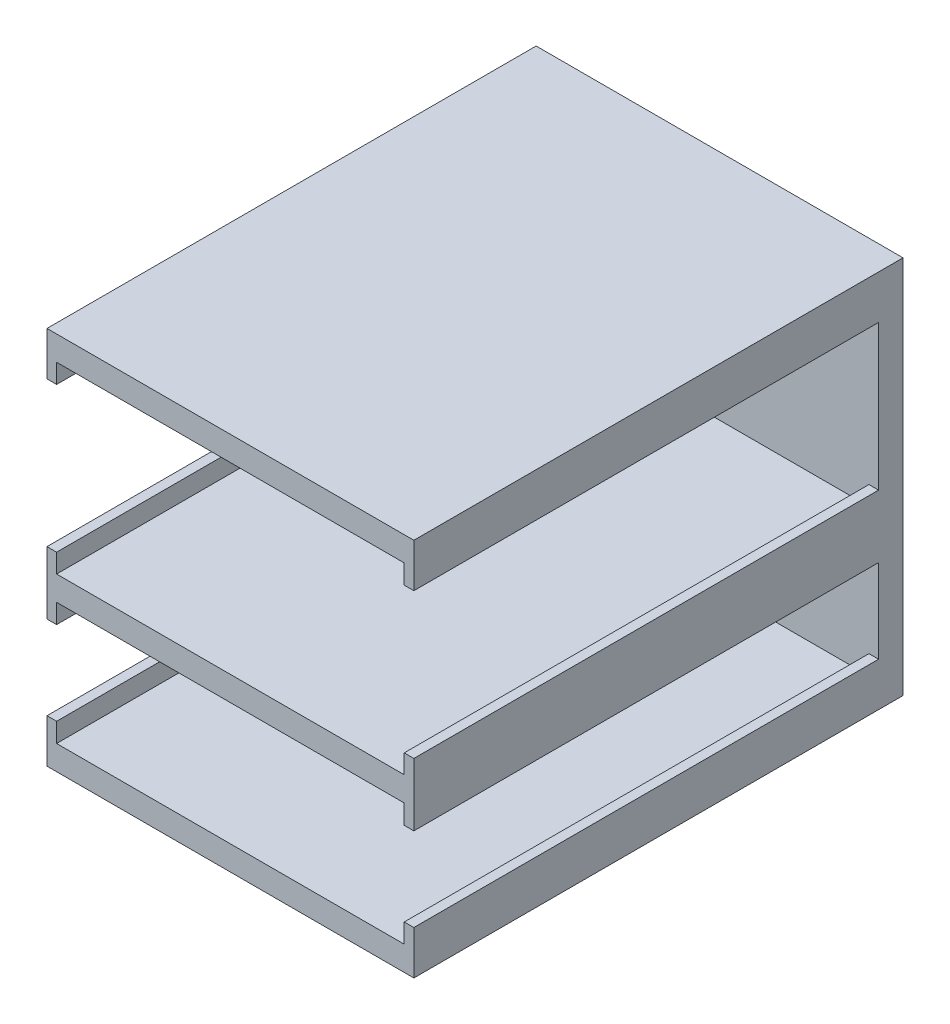
from build123d import *

# Parameters (mm, degrees)
CROQUIS1_W              = 76.2
CROQUIS1_H              = 101.6
SALIENTE_EXTRUIR1_DEPTH = 78.74
CROQUIS2_W              = 76.2
CROQUIS2_H              = 25.4
CORTAR_EXTRUIR1_DEPTH   = 96.52
CROQUIS3_W              = 76.2
CROQUIS3_H              = 38.1
CORTAR_EXTRUIR2_DEPTH   = 96.52
CROQUIS4_W              = 2
CROQUIS4_H              = 96.52
SALIENTE_EXTRUIR3_DEPTH = 73.66
CROQUIS6_W              = 96.52
CROQUIS6_H              = 17.379424015
CORTAR_EXTRUIR4_DEPTH   = 4
CORTAR_EXTRUIR5_DEPTH   = 4


with BuildPart() as part:
    # Croquis1 → Saliente-Extruir1 (new body)
    with BuildSketch(Plane(origin=(0, 0, 0), x_dir=(1, 0, 0), z_dir=(0, 1, 0))):
        Rectangle(CROQUIS1_W, CROQUIS1_H)
    extrude(amount=SALIENTE_EXTRUIR1_DEPTH)

    # Croquis2 → Cortar-Extruir1 (cut)
    with BuildSketch(Plane.XY.offset(50.8)):
        with Locations((0, 17.78)):
            Rectangle(CROQUIS2_W, CROQUIS2_H)
    extrude(amount=-CORTAR_EXTRUIR1_DEPTH, mode=Mode.SUBTRACT)

    # Croquis3 → Cortar-Extruir2 (cut)
    with BuildSketch(Plane.XY.offset(50.8)):
        with Locations((0, 54.61)):
            Rectangle(CROQUIS3_W, CROQUIS3_H)
    extrude(amount=-CORTAR_EXTRUIR2_DEPTH, mode=Mode.SUBTRACT)

    # Croquis4 → Saliente-Extruir3 (add, through all)
    with BuildSketch(Plane(origin=(0, 5.08, 0), x_dir=(1, 0, 0), z_dir=(0, 1, 0))):
        with Locations((-37.1, -2.54)):
            Rectangle(CROQUIS4_W, CROQUIS4_H)
    saliente_extruir3 = extrude(amount=SALIENTE_EXTRUIR3_DEPTH)

    # Croquis6 → Cortar-Extruir4 (cut)
    with BuildSketch(Plane.ZY.offset(38.1)):
        with Locations((2.54, 17.769712008)):
            Rectangle(CROQUIS6_W, CROQUIS6_H)
    cortar_extruir4 = extrude(amount=-CORTAR_EXTRUIR4_DEPTH, mode=Mode.SUBTRACT)

    # Croquis7 → Cortar-Extruir5 (cut)
    with BuildSketch(Plane.ZY.offset(38.1)):
        Polygon((50.8, 39.4956929), (-44.763376085, 39.4956929), (-45.72, 39.4956929), (-45.72, 69.66), (-44.763376085, 69.66), (50.8, 69.66), align=None)
    cortar_extruir5 = extrude(amount=-CORTAR_EXTRUIR5_DEPTH, mode=Mode.SUBTRACT)

    # Simetría1: Saliente-Extruir3, Cortar-Extruir4, Cortar-Extruir5 across plane
    add(saliente_extruir3.mirror(Plane(origin=(0, 0, 0), x_dir=(0, 0, 1), z_dir=(1, 0, 0))))
    add(cortar_extruir4.mirror(Plane(origin=(0, 0, 0), x_dir=(0, 0, 1), z_dir=(1, 0, 0))), mode=Mode.SUBTRACT)
    add(cortar_extruir5.mirror(Plane(origin=(0, 0, 0), x_dir=(0, 0, 1), z_dir=(1, 0, 0))), mode=Mode.SUBTRACT)


solid = part.part
